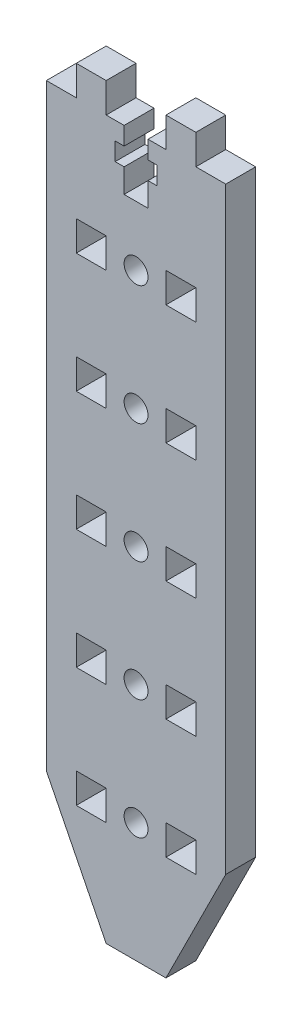
from build123d import *

# Parameters (mm, degrees)
ESQUISSE1_R        = 2
ESQUISSE1_W        = 5
ESQUISSE1_H        = 5
BOSS_EXTRU_1_DEPTH = 5


with BuildPart() as part:
    # Esquisse1 → Boss.-Extru.1 (new body)
    with BuildSketch(Plane.XY):
        Polygon((-10, 100), (-15, 100), (-15, 0), (-5, -20), (5, -20), (15, 0), (15, 100), (10, 100), (10, 105), (5, 105), (5, 100), (2, 100), (2, 97), (3.5, 97), (3.5, 94), (2, 94), (2, 90), (-2, 90), (-2, 94), (-3.5, 94), (-3.5, 97), (-2, 97), (-2, 100), (-5, 100), (-5, 105), (-10, 105), align=None)
        with Locations((0, 40)):
            Circle(ESQUISSE1_R, mode=Mode.SUBTRACT)
        with Locations((0, 20)):
            Circle(ESQUISSE1_R, mode=Mode.SUBTRACT)
        Circle(ESQUISSE1_R, mode=Mode.SUBTRACT)
        with Locations((0, 60)):
            Circle(ESQUISSE1_R, mode=Mode.SUBTRACT)
        with Locations((0, 80)):
            Circle(ESQUISSE1_R, mode=Mode.SUBTRACT)
        with Locations((-7.5, 40)):
            Rectangle(ESQUISSE1_W, ESQUISSE1_H, mode=Mode.SUBTRACT)
        with Locations((7.5, 40)):
            Rectangle(ESQUISSE1_W, ESQUISSE1_H, mode=Mode.SUBTRACT)
        with Locations((-7.5, 20)):
            Rectangle(ESQUISSE1_W, ESQUISSE1_H, mode=Mode.SUBTRACT)
        with Locations((7.5, 20)):
            Rectangle(ESQUISSE1_W, ESQUISSE1_H, mode=Mode.SUBTRACT)
        with Locations((-7.5, 0)):
            Rectangle(ESQUISSE1_W, ESQUISSE1_H, mode=Mode.SUBTRACT)
        with Locations((7.5, 0)):
            Rectangle(ESQUISSE1_W, ESQUISSE1_H, mode=Mode.SUBTRACT)
        with Locations((-7.5, 60)):
            Rectangle(ESQUISSE1_W, ESQUISSE1_H, mode=Mode.SUBTRACT)
        with Locations((7.5, 60)):
            Rectangle(ESQUISSE1_W, ESQUISSE1_H, mode=Mode.SUBTRACT)
        with Locations((-7.5, 80)):
            Rectangle(ESQUISSE1_W, ESQUISSE1_H, mode=Mode.SUBTRACT)
        with Locations((7.5, 80)):
            Rectangle(ESQUISSE1_W, ESQUISSE1_H, mode=Mode.SUBTRACT)
    extrude(amount=BOSS_EXTRU_1_DEPTH)


solid = part.part
